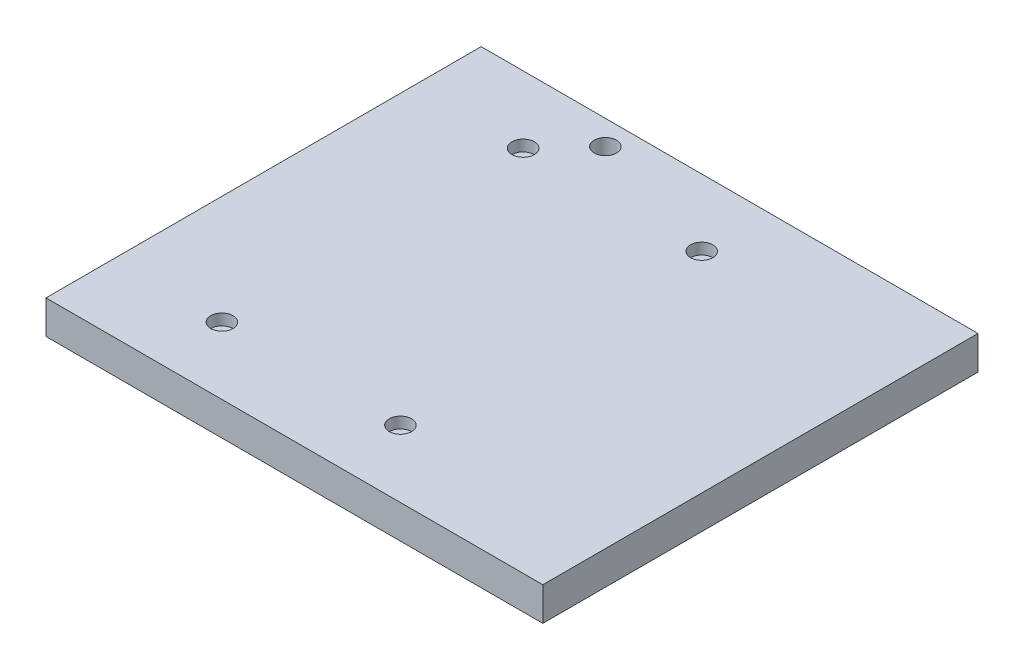
from build123d import *

# Parameters (mm, degrees)
SKETCH1_W               = 355.26
SKETCH1_H               = 390
BOSS_EXTRUDE1_DEPTH     = 30
SKETCH3_W               = 390
SKETCH3_H               = 30
BOSS_EXTRUDE2_DEPTH     = 90
SKETCH4_R               = 10
CUT_EXTRUDE1_DEPTH      = 10
MIRROR2_COPY_1_SKETCH_R = 10
MIRROR2_COPY_1_DEPTH    = 10
SKETCH7_W               = 335.26
SKETCH7_H               = 370
CUT_EXTRUDE3_DEPTH      = 10
SKETCH8_R               = 10
CUT_EXTRUDE4_DEPTH      = 87


with BuildPart() as part:
    # Sketch1 → Boss-Extrude1 (new body)
    with BuildSketch(Plane(origin=(0, 0, 0), x_dir=(1, 0, 0), z_dir=(0, 1, 0))):
        with Locations((177.63, -195)):
            Rectangle(SKETCH1_W, SKETCH1_H)
    extrude(amount=BOSS_EXTRUDE1_DEPTH)

    # Sketch3 → Boss-Extrude2 (add)
    with BuildSketch(Plane(origin=(355.26, 0, 0), x_dir=(0, 0, -1), z_dir=(1, 0, 0))):
        with Locations((-195, 15)):
            Rectangle(SKETCH3_W, SKETCH3_H)
    extrude(amount=BOSS_EXTRUDE2_DEPTH)

    # Sketch4 → Cut-Extrude1 (cut)
    with BuildSketch(Plane(origin=(0, 30, 0), x_dir=(1, 0, 0), z_dir=(0, 1, 0))):
        with Locations(Location((97.63, -60, 0), (0, 0, 270))):
            Circle(SKETCH4_R)
    cut_extrude1 = extrude(amount=-CUT_EXTRUDE1_DEPTH, mode=Mode.SUBTRACT)

    # Mirror1: Cut-Extrude1 across plane
    add(cut_extrude1.mirror(Plane.ZY.offset(-177.63)), mode=Mode.SUBTRACT)

    # Mirror2: Cut-Extrude1 across plane
    add(cut_extrude1.mirror(Plane.XY.offset(195)), mode=Mode.SUBTRACT)

    # Mirror2 copy 1 sketch → Mirror2 copy 1 (cut)
    with BuildSketch(Plane(origin=(355.26, 30, 390), x_dir=(-1, 0, 0), z_dir=(0, 1, 0))):
        with Locations(Location((97.63, -60, 0), (0, 0, 270))):
            Circle(MIRROR2_COPY_1_SKETCH_R)
    extrude(amount=-MIRROR2_COPY_1_DEPTH, mode=Mode.SUBTRACT)

    # Sketch7 → Cut-Extrude3 (cut)
    with BuildSketch(Plane.XZ):
        with Locations((187.63, 195)):
            Rectangle(SKETCH7_W, SKETCH7_H)
    extrude(amount=-CUT_EXTRUDE3_DEPTH, mode=Mode.SUBTRACT)

    # Sketch8 → Cut-Extrude4 (cut)
    with BuildSketch(Plane(origin=(0, 30, 0), x_dir=(1, 0, 0), z_dir=(0, 1, 0))):
        with Locations(Location((133.244825989, -21.940410103, 0), (0, 0, 270))):
            Circle(SKETCH8_R)
    extrude(amount=-CUT_EXTRUDE4_DEPTH, mode=Mode.SUBTRACT)


solid = part.part
